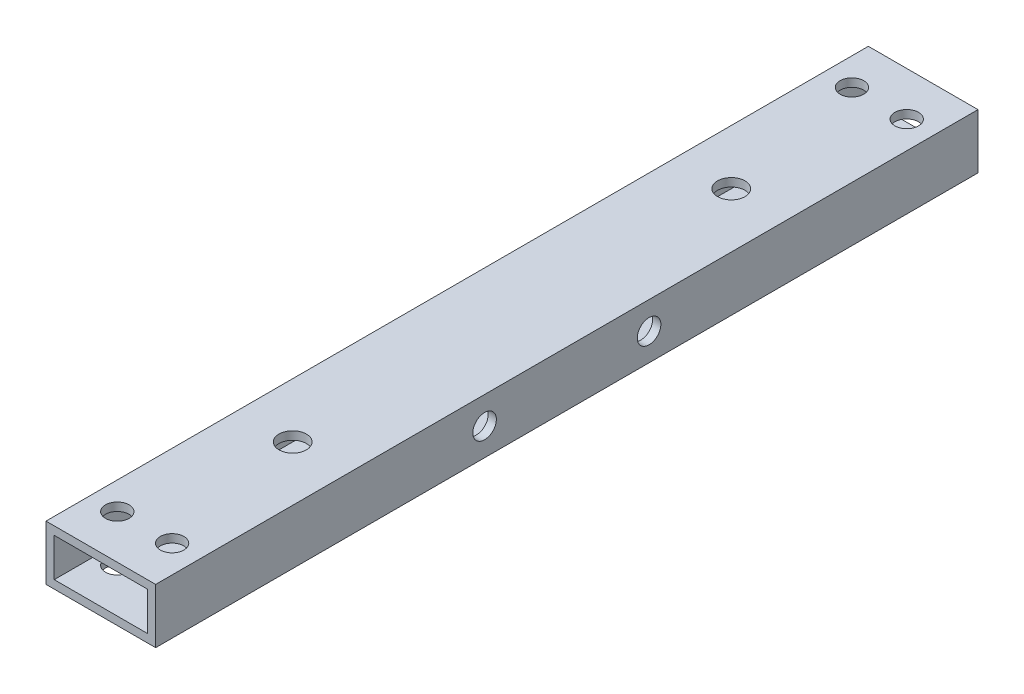
from build123d import *

# Parameters (mm, degrees)
SKETCH_1_W          = 20
SKETCH_1_H          = 10
SKETCH_1_W_2        = 17
SKETCH_1_H_2        = 7
EXTRUDE_1_DEPTH     = 150
SKETCH_2_R          = 2.15
SKETCH_2_R_2        = 2.5
CUT_EXTRUDE_1_DEPTH = 151.665191733
SKETCH_3_R          = 2.15
CUT_EXTRUDE_2_DEPTH = 152.410039297


with BuildPart() as part:
    # ｽｹｯﾁ1 → 押し出し-薄板1 (new body)
    with BuildSketch(Plane.XY):
        Rectangle(SKETCH_1_W, SKETCH_1_H)
        Rectangle(SKETCH_1_W_2, SKETCH_1_H_2, mode=Mode.SUBTRACT)
    extrude(amount=EXTRUDE_1_DEPTH)

    # ｽｹｯﾁ2 → ｶｯﾄ - 押し出し1 (cut, through all)
    with BuildSketch(Plane(origin=(0, 5, 0), x_dir=(1, 0, 0), z_dir=(0, 1, 0))):
        with Locations(Location((5, -142, 0), (0, 0, 270))):
            Circle(SKETCH_2_R)
        with Locations(Location((-5, -142, 0), (0, 0, 270))):
            Circle(SKETCH_2_R)
        with Locations(Location((5, -8, 0), (0, 0, 270))):
            Circle(SKETCH_2_R)
        with Locations(Location((-5, -8, 0), (0, 0, 270))):
            Circle(SKETCH_2_R)
        with Locations(Location((0, -35, 0), (0, 0, 270))):
            Circle(SKETCH_2_R_2)
        with Locations(Location((0, -115, 0), (0, 0, 270))):
            Circle(SKETCH_2_R_2)
    extrude(amount=-CUT_EXTRUDE_1_DEPTH, mode=Mode.SUBTRACT)

    # ｽｹｯﾁ3 → ｶｯﾄ - 押し出し2 (cut, through all)
    with BuildSketch(Plane(origin=(10, 0, 0), x_dir=(0, 0, -1), z_dir=(1, 0, 0))):
        with Locations((-60, 0)):
            Circle(SKETCH_3_R)
        with Locations(Location((-90, 0, 0), (0, 0, 90))):
            Circle(SKETCH_3_R)
    extrude(amount=-CUT_EXTRUDE_2_DEPTH, mode=Mode.SUBTRACT)


solid = part.part
